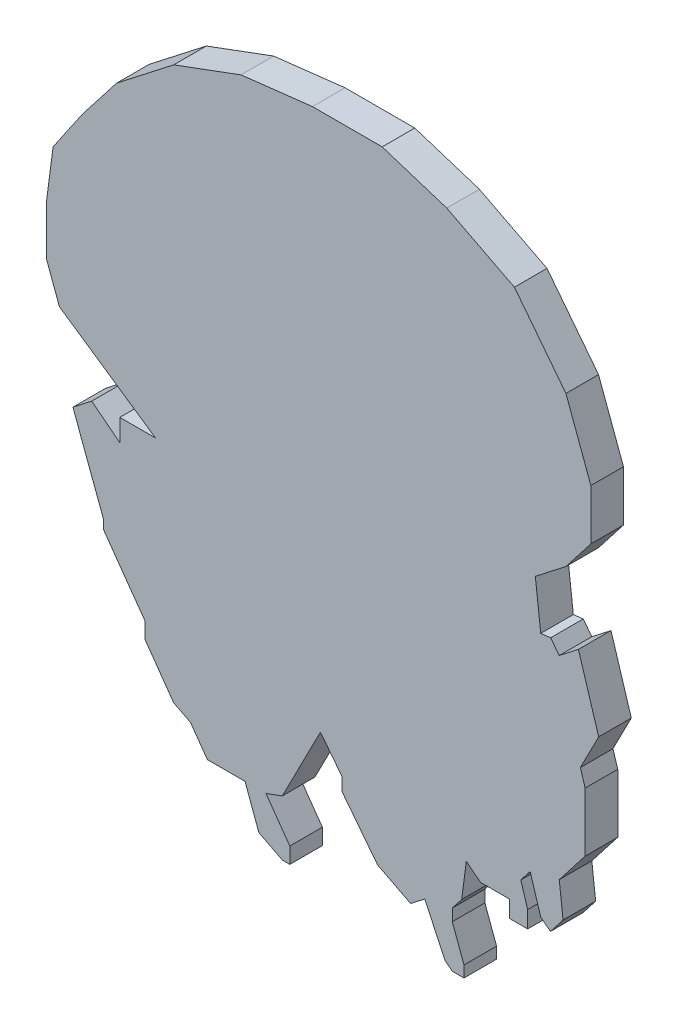
from build123d import *

# Parameters (mm, degrees)
EXTRUDE_1_DEPTH = 10


with BuildPart() as part:
    # Эскиз1 → Бобышка-Вытянуть1 (new body)
    with BuildSketch(Plane.XY):
        Polygon((-53.85138596, 14.018578311), (-57.04541686, 22.64246174), (-51.296161241, 27.114105), (-42.672277811, 20.40664011), (-42.672277811, 27.114105), (-31.732721979, 27.114105), (-61.19765703, 47.236499669), (-65.092910636, 57.753684406), (-65.092910636, 73.746956137), (-63.145283833, 88.758901366), (-54.17078905, 101.900125869), (-43.667374626, 115.404515844), (-26.130435815, 129.044357141), (-5.466398977, 136.697704118), (16.417293835, 139.224589583), (37.817300864, 139.224589583), (57.620292443, 132.871030629), (78.381493292, 122.224436492), (94.189290443, 101.900125869), (101.836400486, 81.252928751), (101.836400486, 65.750320271), (94.189290443, 55.918321644), (84.798214398, 48.614151387), (86.452679963, 34.285913445), (89.49375242, 34.637062671), (92.132772709, 31.244036586), (98.012845465, 35.817426507), (104.233890809, 15.685456171), (98.619402154, 4.737022793), (100.083204907, 0), (100.083204907, -10.326628952), (100.083204907, -18.075202764), (92.132772709, -28.297187018), (93.303752164, -38.438269801), (89.436859181, -43.40998935), (86.452679963, -41.088961069), (83.206856787, -30.585128953), (80.338686983, -34.272775844), (82.444978452, -41.088961069), (82.444978452, -46.241720155), (76.912286554, -46.241720155), (76.912286554, -41.088961069), (68.000892867, -41.088961069), (63.619059508, -37.680868456), (62.211127726, -48.532944823), (59.324618186, -52.244171373), (59.324618186, -55.882780265), (62.915093617, -65.577063928), (62.915093617, -69.038718479), (59.324618186, -69.038718479), (57.099268832, -67.307891203), (50.877031559, -54.063475819), (46.532092284, -57.442873034), (36.394456911, -52.244171373), (25.513596442, -38.254493627), (25.513596442, -34.272775844), (18.873446088, -25.735439675), (14.495397156, -34.272775844), (8.866486546, -45.2493325), (7.182610552, -48.532944823), (2.172454709, -50.388558098), (7.182610552, -57.442873034), (9.485737931, -60.685683511), (9.485737931, -65.577063928), (7.182610552, -65.577063928), (0, -61.893734627), (-1.648467257, -57.442873034), (-4.261176492, -50.388558098), (-7.199449567, -50.388558098), (-12.097138316, -50.388558098), (-15.798417396, -50.388558098), (-20.970033483, -43.10690664), (-26.130435815, -40.460590099), (-29.111221424, -36.263634735), (-34.898905221, -28.114558035), (-34.898905221, -23.186194891), (-37.202499895, -19.942726459), (-47.699218285, -5.163314476), (-47.699218285, -2.378627093), align=None)
    extrude(amount=EXTRUDE_1_DEPTH)


solid = part.part
